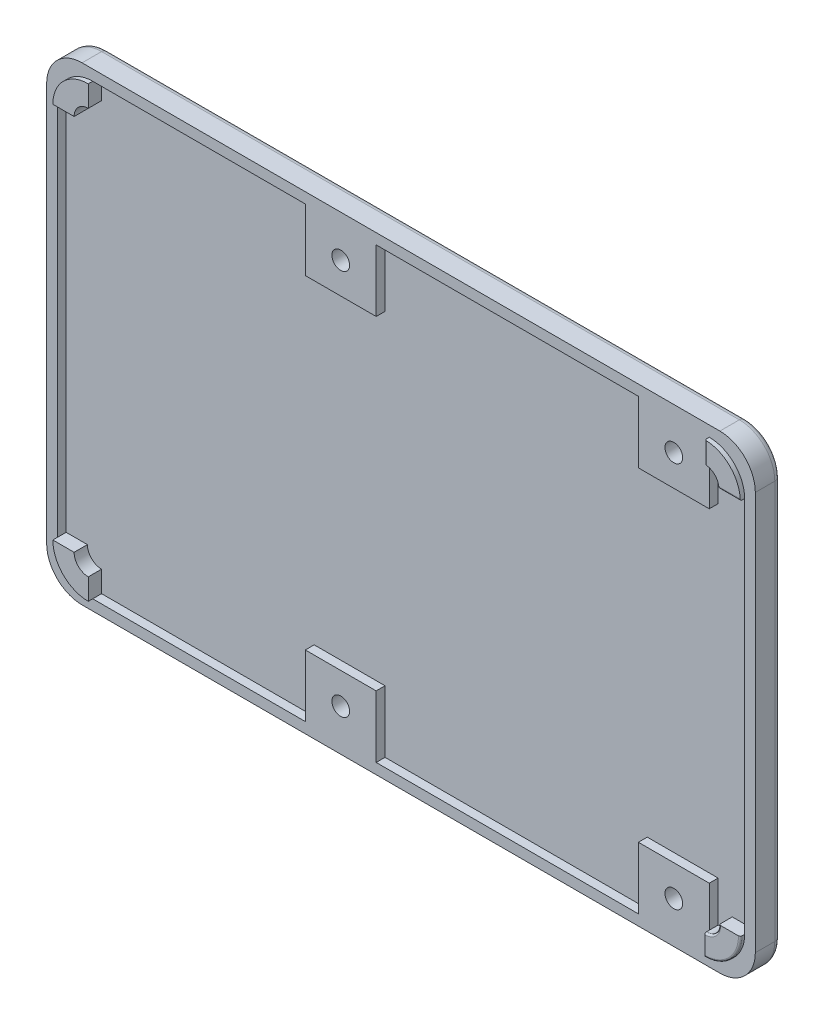
from build123d import *

# Parameters (mm, degrees)
ESQUISSE4_W                                = 80
ESQUISSE4_H                                = 53
BOSS_EXTRU_1_DEPTH                         = 2.9
ESQUISSE6_W                                = 77.6
ESQUISSE6_H                                = 50.6
ENL_V_MAT_EXTRU_1_DEPTH                    = 1
CONG_1_R                                   = 4
CONG_2_R                                   = 0.7
BOSS_EXTRU_2_DEPTH                         = 1.5
SYM_TRIE1_AT_THE_SECOND_PLANE_COPY_1_DEPTH = 1.5
ESQUISSE11_W                               = 8
ESQUISSE11_H                               = 7
BOSS_EXTRU_3_DEPTH                         = 1
ESQUISSE12_R                               = 1
ENL_V_MAT_EXTRU_2_DEPTH                    = 49.069324938
CONG_3_R                                   = 0.2
CONG_3_OF_SYM_TRIE3_R                      = 0.2
ESQUISSE15_W                               = 8
ESQUISSE15_H                               = 7
BOSS_EXTRU_4_DEPTH                         = 1
ESQUISSE16_R                               = 1
ENL_V_MAT_EXTRU_3_DEPTH                    = 49.069324938
CONG_4_R                                   = 0.2
CONG_4_OF_SYM_TRIE4_R                      = 0.2
CONG_5_R                                   = 0.2


with BuildPart() as part:
    # Esquisse4 → Boss.-Extru.1 (new body)
    with BuildSketch(Plane.XY):
        Rectangle(ESQUISSE4_W, ESQUISSE4_H)
    extrude(amount=BOSS_EXTRU_1_DEPTH)

    # Esquisse6 → Enlèv. mat.-Extru.1 (cut)
    with BuildSketch(Plane.XY.offset(2.9)):
        Rectangle(ESQUISSE6_W, ESQUISSE6_H)
    extrude(amount=-ENL_V_MAT_EXTRU_1_DEPTH, mode=Mode.SUBTRACT)

    # Congé1
    cong_1_edges = [part.edges().sort_by_distance(p)[0] for p in [
        (38.8, 25.3, 2.4),
        (38.8, -25.3, 2.4),
        (-38.8, -25.3, 2.4),
        (-38.8, 25.3, 2.4),
        (40, -26.5, 1.45),
        (-40, -26.5, 1.45),
        (-40, 26.5, 1.45),
        (40, 26.5, 1.45),
    ]]
    fillet(cong_1_edges, radius=CONG_1_R)

    # Congé2
    cong_2_edges = [part.edges().sort_by_distance(p)[0] for p in [
        (0, -26.5, 0),
        (40, 0, 0),
        (-40, 0, 0),
        (0, 26.5, 0),
        (-38.828427125, 25.328427125, 0),
        (38.828427125, 25.328427125, 0),
        (38.828427125, -25.328427125, 0),
        (-38.828427125, -25.328427125, 0),
    ]]
    fillet(cong_2_edges, radius=CONG_2_R)

    # Esquisse8 → Boss.-Extru.2 (add)
    with BuildSketch(Plane.XY.offset(1.9)):
        with BuildLine():
            Line((-36.4, 21.3), (-38.8, 21.3))
            ThreePointArc((-38.8, 21.3), (-37.628427125, 24.128427125), (-34.8, 25.3))
            Line((-34.8, 25.3), (-34.8, 22.9))
            ThreePointArc((-34.8, 22.9), (-35.93137085, 22.43137085), (-36.4, 21.3))
        make_face()
    boss_extru_2 = extrude(amount=BOSS_EXTRU_2_DEPTH)

    # Symétrie1: Boss.-Extru.2 across plane
    add(boss_extru_2.mirror(Plane(origin=(0, 0, 0), x_dir=(0, 0, 1), z_dir=(1, 0, 0))))

    # Symétrie1 at the second plane: Boss.-Extru.2 across plane
    add(boss_extru_2.mirror(Plane.ZX))

    # Symétrie1 at the second plane copy 1 ske → Symétrie1 at the second plane copy 1 (add)
    with BuildSketch(Plane(origin=(0, 0, 1.9), x_dir=(-1, 0, 0), z_dir=(0, 0, 1))):
        with BuildLine():
            Line((-36.4, 21.3), (-38.8, 21.3))
            ThreePointArc((-38.8, 21.3), (-37.628427125, 24.128427125), (-34.8, 25.3))
            Line((-34.8, 25.3), (-34.8, 22.9))
            ThreePointArc((-34.8, 22.9), (-35.93137085, 22.43137085), (-36.4, 21.3))
        make_face()
    extrude(amount=SYM_TRIE1_AT_THE_SECOND_PLANE_COPY_1_DEPTH)

    # Esquisse11 → Boss.-Extru.3 (add)
    with BuildSketch(Plane.XY.offset(1.9)):
        with Locations((-6.8, 21.8)):
            Rectangle(ESQUISSE11_W, ESQUISSE11_H)
    boss_extru_3 = extrude(amount=BOSS_EXTRU_3_DEPTH)

    # Symétrie2: Boss.-Extru.3 across plane
    add(boss_extru_3.mirror(Plane.ZX))

    # Esquisse12 → Enlèv. mat.-Extru.2 (cut, through all)
    with BuildSketch(Plane.XY.offset(2.9)):
        with Locations((-6.8, 21.8)):
            Circle(ESQUISSE12_R)
    enl_v_mat_extru_2 = extrude(amount=-ENL_V_MAT_EXTRU_2_DEPTH, mode=Mode.SUBTRACT)

    # Congé3
    cong_3_edges = [part.edges().sort_by_distance(p)[0] for p in [
        (-7.8, 21.8, 0),
    ]]
    fillet(cong_3_edges, radius=CONG_3_R)

    # Symétrie3: Enlèv. mat.-Extru.2 across plane
    add(enl_v_mat_extru_2.mirror(Plane.ZX), mode=Mode.SUBTRACT)

    # Congé3 of Symétrie3
    cong_3_of_sym_trie3_edges = [part.edges().sort_by_distance(p)[0] for p in [
        (-7.8, -21.8, 0),
    ]]
    fillet(cong_3_of_sym_trie3_edges, radius=CONG_3_OF_SYM_TRIE3_R)

    # Esquisse15 → Boss.-Extru.4 (add)
    with BuildSketch(Plane.XY.offset(1.9)):
        with Locations((30.8, 21.8)):
            Rectangle(ESQUISSE15_W, ESQUISSE15_H)
    boss_extru_4 = extrude(amount=BOSS_EXTRU_4_DEPTH)

    # Esquisse16 → Enlèv. mat.-Extru.3 (cut, through all)
    with BuildSketch(Plane.XY.offset(2.9)):
        with Locations((30.8, 21.8)):
            Circle(ESQUISSE16_R)
    enl_v_mat_extru_3 = extrude(amount=-ENL_V_MAT_EXTRU_3_DEPTH, mode=Mode.SUBTRACT)

    # Congé4
    cong_4_edges = [part.edges().sort_by_distance(p)[0] for p in [
        (29.8, 21.8, 0),
    ]]
    fillet(cong_4_edges, radius=CONG_4_R)

    # Symétrie4: Boss.-Extru.4, Enlèv. mat.-Extru.3 across plane
    add(boss_extru_4.mirror(Plane.ZX))
    add(enl_v_mat_extru_3.mirror(Plane.ZX), mode=Mode.SUBTRACT)

    # Congé4 of Symétrie4
    cong_4_of_sym_trie4_edges = [part.edges().sort_by_distance(p)[0] for p in [
        (29.8, -21.8, 0),
    ]]
    fillet(cong_4_of_sym_trie4_edges, radius=CONG_4_OF_SYM_TRIE4_R)

    # Congé5
    cong_5_edges = [part.edges().sort_by_distance(p)[0] for p in [
        (34.8, 24.1, 3.4),
        (37.6, 21.3, 3.4),
        (37.628427125, -24.128427125, 3.4),
        (35.93137085, -22.43137085, 3.4),
    ]]
    fillet(cong_5_edges, radius=CONG_5_R)


solid = part.part
